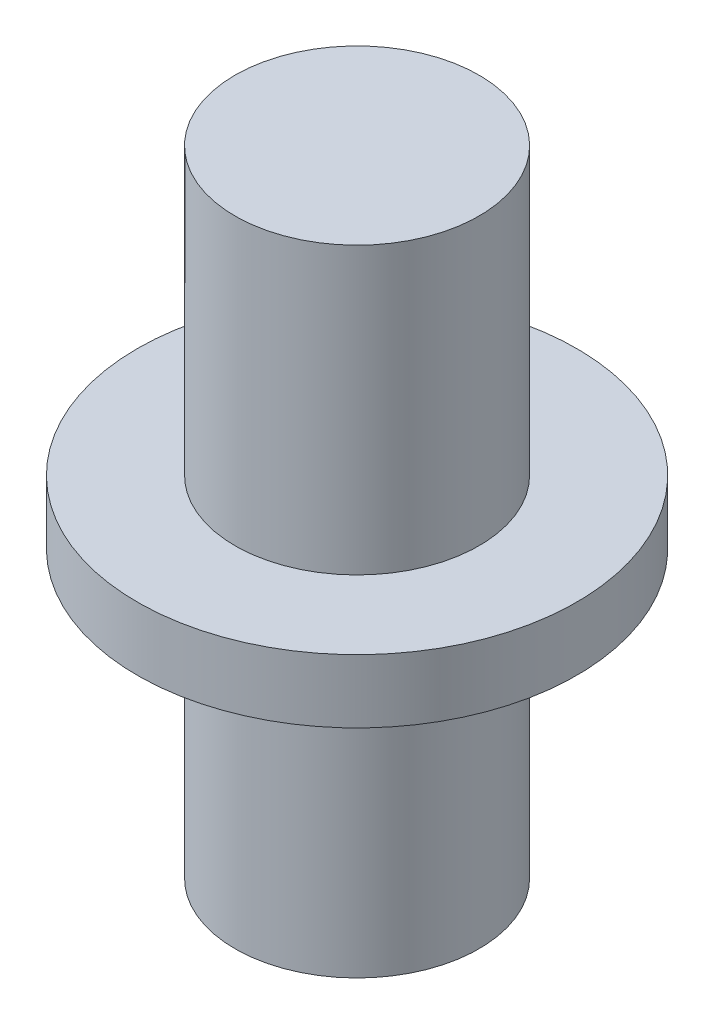
from build123d import *


with BuildPart() as part:
    # 草图1 → 旋转1 (revolve)
    with BuildSketch(Plane.XY, mode=Mode.PRIVATE) as revolve_1_sk:
        Polygon((0, 13), (0, 0), (2.5, 0), (2.5, 5.85), (4.5, 5.85), (4.5, 7.15), (2.5, 7.15), (2.5, 13), align=None)
    revolve(revolve_1_sk.sketch.rotate(Axis((0, 13, 0), (0, -1, 0)), 180), axis=Axis((0, 13, 0), (0, -1, 0)))


solid = part.part
